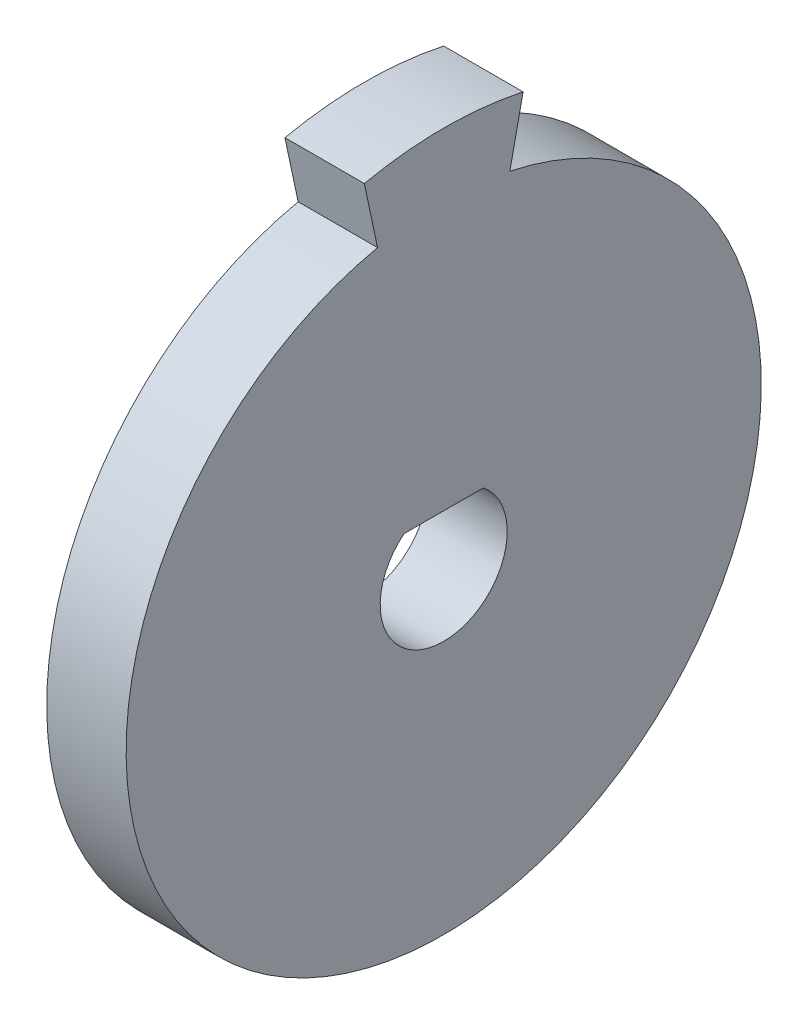
from build123d import *

# Parameters (mm, degrees)
SKETCH1_R           = 25.4
BOSS_EXTRUDE1_DEPTH = 3.175
BOSS_EXTRUDE2_DEPTH = 3.175


with BuildPart() as part:
    # Sketch1 → Boss-Extrude1 (new, symmetric)
    with BuildSketch(Plane(origin=(0, 0, 0), x_dir=(0, 0, -1), z_dir=(1, 0, 0))):
        Circle(SKETCH1_R)
        with BuildLine():
            Line((-3.175, 3.965573729), (3.175, 3.965573729))
            ThreePointArc((3.175, 3.965573729), (0, -5.08), (-3.175, 3.965573729))
        make_face(mode=Mode.SUBTRACT)
    extrude(amount=BOSS_EXTRUDE1_DEPTH, both=True)

    # Sketch2 → Boss-Extrude2 (add, symmetric)
    with BuildSketch(Plane(origin=(0, 0, 0), x_dir=(0, 0, -1), z_dir=(1, 0, 0))):
        with BuildLine():
            Line((-5.291666667, 24.842670225), (-6.35, 29.81120427))
            ThreePointArc((-6.35, 29.81120427), (0, 30.48), (6.35, 29.81120427))
            Line((6.35, 29.81120427), (5.291666667, 24.842670225))
            ThreePointArc((5.291666667, 24.842670225), (0, 25.4), (-5.291666667, 24.842670225))
        make_face()
    extrude(amount=BOSS_EXTRUDE2_DEPTH, both=True)


solid = part.part
